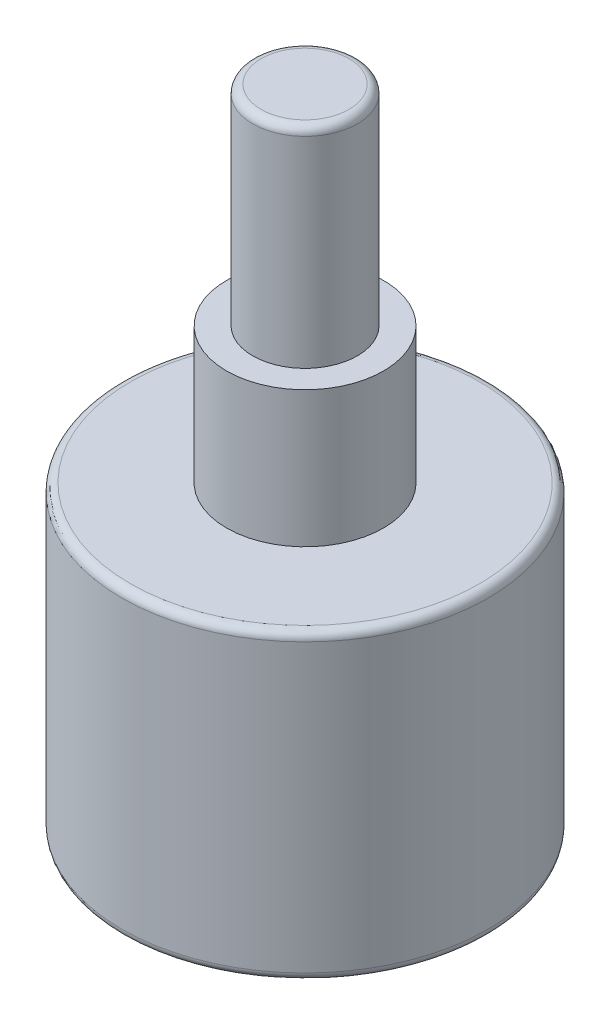
from build123d import *

# Parameters (mm, degrees)
SKETCH1_R           = 11.1125
BOSS_EXTRUDE1_DEPTH = 18.415
SKETCH2_R           = 4.7625
BOSS_EXTRUDE2_DEPTH = 8.255
SKETCH3_R           = 3.175
BOSS_EXTRUDE3_DEPTH = 12.7
FILLET1_R           = 0.508
FILLET2_R           = 0.508


with BuildPart() as part:
    # Sketch1 → Boss-Extrude1 (new body)
    with BuildSketch(Plane(origin=(0, 0, 0), x_dir=(1, 0, 0), z_dir=(0, 1, 0))):
        with Locations(Location((0, 0, 0), (0, 0, 270))):
            Circle(SKETCH1_R)
    extrude(amount=BOSS_EXTRUDE1_DEPTH)

    # Sketch2 → Boss-Extrude2 (add)
    with BuildSketch(Plane(origin=(0, 18.415, 0), x_dir=(1, 0, 0), z_dir=(0, 1, 0))):
        with Locations(Location((0, 0, 0), (0, 0, 270))):
            Circle(SKETCH2_R)
    extrude(amount=BOSS_EXTRUDE2_DEPTH)

    # Sketch3 → Boss-Extrude3 (add)
    with BuildSketch(Plane(origin=(0, 26.67, 0), x_dir=(1, 0, 0), z_dir=(0, 1, 0))):
        with Locations(Location((0, 0, 0), (0, 0, 270))):
            Circle(SKETCH3_R)
    extrude(amount=BOSS_EXTRUDE3_DEPTH)

    # Fillet1
    fillet1_edges = [part.edges().sort_by_distance(p)[0] for p in [
        (0, 0, -11.1125),
        (0, 18.415, -11.1125),
    ]]
    fillet(fillet1_edges, radius=FILLET1_R)

    # Fillet2
    fillet2_edges = [part.edges().sort_by_distance(p)[0] for p in [
        (0, 39.37, -3.175),
    ]]
    fillet(fillet2_edges, radius=FILLET2_R)


solid = part.part
